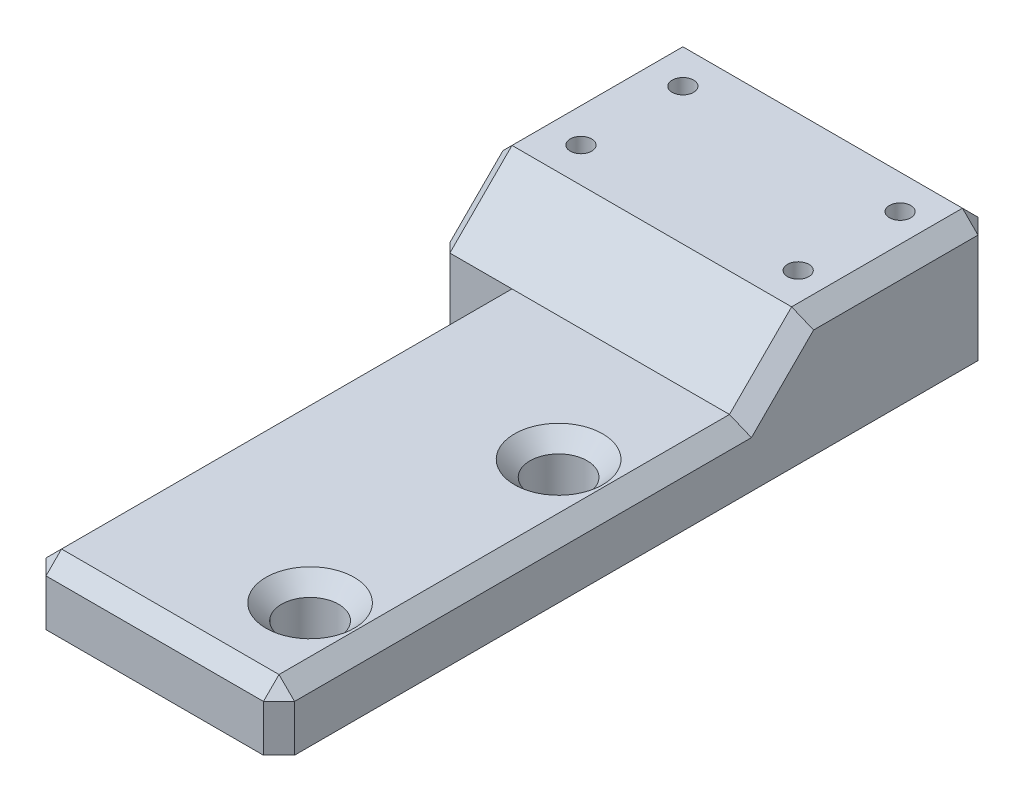
from build123d import *

# Parameters (mm, degrees)
SKETCH1_W           = 31.75
SKETCH1_H           = 73.025
SKETCH1_R           = 2.921
BOSS_EXTRUDE1_DEPTH = 12.7
SKETCH2_W           = 47.625
SKETCH2_H           = 6.35
CUT_EXTRUDE1_DEPTH  = 81.63499938
SKETCH3_R           = 1.0922
SKETCH3_W           = 6.35
SKETCH3_H           = 47.625
CUT_EXTRUDE2_DEPTH  = 81.63499938
CHAMFER1_SIZE       = 6.35
CHAMFER2_SIZE       = 1.5875


with BuildPart() as part:
    # Sketch1 → Boss-Extrude1 (new body)
    with BuildSketch(Plane(origin=(0, 0, 0), x_dir=(1, 0, 0), z_dir=(0, 1, 0))):
        with Locations((15.875, 36.5125)):
            Rectangle(SKETCH1_W, SKETCH1_H)
        with Locations(Location((25.4, 9.525, 0), (0, 0, 270))):
            Circle(SKETCH1_R, mode=Mode.SUBTRACT)
        with Locations(Location((25.4, 34.925, 0), (0, 0, 270))):
            Circle(SKETCH1_R, mode=Mode.SUBTRACT)
    extrude(amount=BOSS_EXTRUDE1_DEPTH)

    # Sketch2 → Cut-Extrude1 (cut, through all)
    with BuildSketch(Plane(origin=(31.75, 0, 0), x_dir=(0, 0, -1), z_dir=(1, 0, 0))):
        with Locations((23.8125, 9.525)):
            Rectangle(SKETCH2_W, SKETCH2_H)
    extrude(amount=-CUT_EXTRUDE1_DEPTH, mode=Mode.SUBTRACT)

    # Sketch3 → Cut-Extrude2 (cut, through all)
    with BuildSketch(Plane.XZ):
        with Locations(Location((27.2796, -57.531, 0), (0, 0, 270))):
            Circle(SKETCH3_R)
        with Locations(Location((5.08, -67.945, 0), (0, 0, 270))):
            Circle(SKETCH3_R)
        with Locations(Location((27.2796, -67.945, 0), (0, 0, 270))):
            Circle(SKETCH3_R)
        with Locations(Location((5.08, -57.531, 0), (0, 0, 270))):
            Circle(SKETCH3_R)
        with Locations((3.175, -23.8125)):
            Rectangle(SKETCH3_W, SKETCH3_H)
    extrude(amount=-CUT_EXTRUDE2_DEPTH, mode=Mode.SUBTRACT)

    # Chamfer1
    chamfer1_edges = [part.edges().sort_by_distance(p)[0] for p in [
        (15.875, 12.7, -47.625),
    ]]
    chamfer(chamfer1_edges, length=CHAMFER1_SIZE)

    # Chamfer2
    chamfer2_edges = [part.edges().sort_by_distance(p)[0] for p in [
        (15.875, 12.7, -73.025),
        (31.75, 3.175, 0),
        (25.4, 6.35, -12.446),
        (25.4, 6.35, -37.846),
        (0, 3.175, -47.625),
        (31.75, 6.35, -23.8125),
        (19.05, 6.35, 0),
        (6.35, 6.35, -23.8125),
        (0, 12.7, -63.5),
        (6.35, 3.175, 0),
        (0, 6.35, -73.025),
        (31.75, 6.35, -73.025),
        (31.75, 12.7, -63.5),
        (31.75, 9.525, -50.8),
        (0, 9.525, -50.8),
    ]]
    chamfer(chamfer2_edges, length=CHAMFER2_SIZE)


solid = part.part
